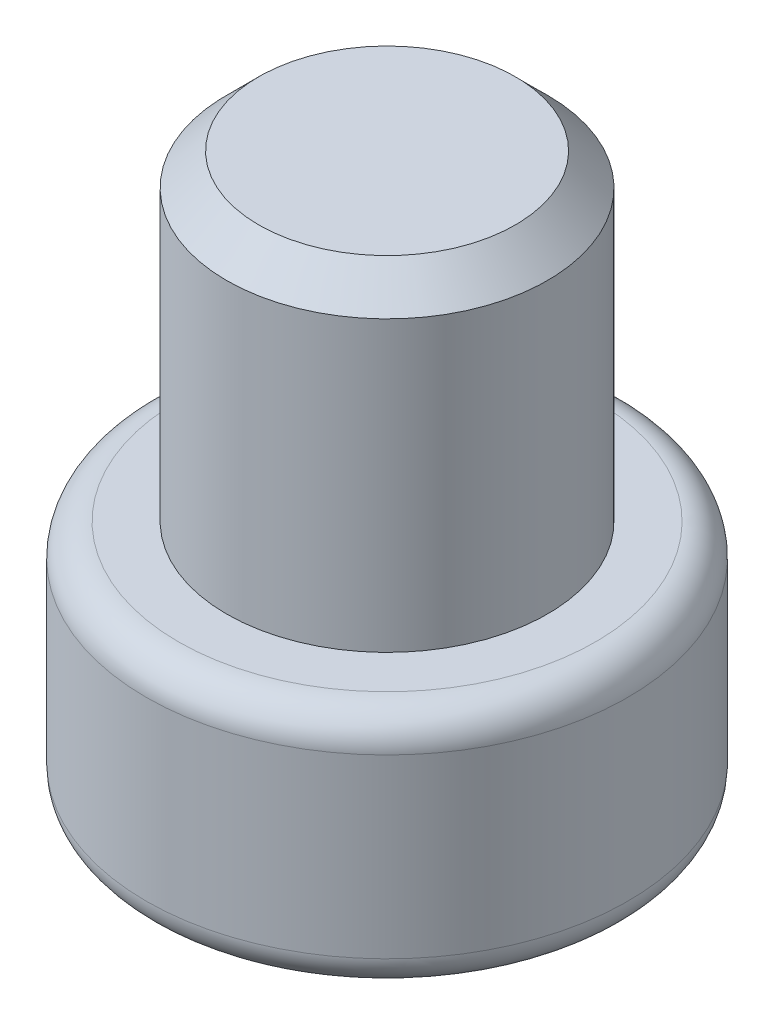
from build123d import *

# Parameters (mm, degrees)
SKETCH1_R           = 15
SKETCH1_R_2         = 10.5
BOSS_EXTRUDE1_DEPTH = 10
SKETCH2_R           = 15
BOSS_EXTRUDE2_DEPTH = 5
SKETCH3_R           = 10
BOSS_EXTRUDE3_DEPTH = 20
CHAMFER2_SIZE       = 2
FILLET1_R           = 2


with BuildPart() as part:
    # Sketch1 → Boss-Extrude1 (new body)
    with BuildSketch(Plane(origin=(0, 0, 0), x_dir=(1, 0, 0), z_dir=(0, 1, 0))):
        with Locations(Location((0, 0, 0), (0, 0, 270))):
            Circle(SKETCH1_R)
        with Locations(Location((0, 0, 0), (0, 0, 270))):
            Circle(SKETCH1_R_2, mode=Mode.SUBTRACT)
    extrude(amount=BOSS_EXTRUDE1_DEPTH)

    # Sketch2 → Boss-Extrude2 (add)
    with BuildSketch(Plane(origin=(0, 10, 0), x_dir=(1, 0, 0), z_dir=(0, 1, 0))):
        with Locations(Location((0, 0, 0), (0, 0, 270))):
            Circle(SKETCH2_R)
    extrude(amount=BOSS_EXTRUDE2_DEPTH)

    # Sketch3 → Boss-Extrude3 (add)
    with BuildSketch(Plane(origin=(0, 15, 0), x_dir=(1, 0, 0), z_dir=(0, 1, 0))):
        with Locations(Location((0, 0, 0), (0, 0, 270))):
            Circle(SKETCH3_R)
    extrude(amount=BOSS_EXTRUDE3_DEPTH)

    # Chamfer2
    chamfer2_edges = [part.edges().sort_by_distance(p)[0] for p in [
        (0, 35, -10),
    ]]
    chamfer(chamfer2_edges, length=CHAMFER2_SIZE)

    # Fillet1
    fillet1_edges = [part.edges().sort_by_distance(p)[0] for p in [
        (0, 0, -15),
        (0, 15, -15),
    ]]
    fillet(fillet1_edges, radius=FILLET1_R)


solid = part.part
